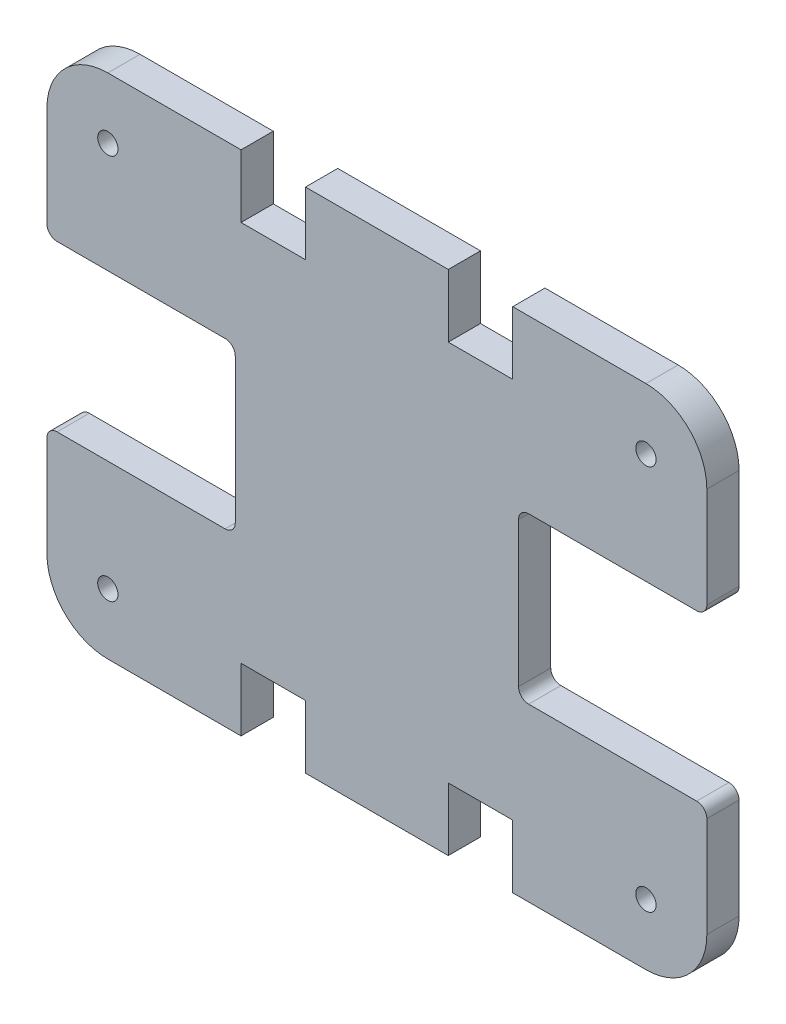
from build123d import *

# Parameters (mm, degrees)
OVERALL_DIMENSIONS_W    = 65
OVERALL_DIMENSIONS_H    = 50
RECTANGULAR_PLATE_DEPTH = 3.175
EXTERNAL_4_FILLETS_R    = 6
HOLE_POSITIONS_R        = 1
CORNER_HOLES_DEPTH      = 42.125790266
RJ45_GEOMETRY_W         = 18.55
RJ45_GEOMETRY_H         = 16.24
RJ45_CUTOUTS_DEPTH      = 42.125790266
CLIP_SLOT_GEOMETRY_W    = 6.35
CLIP_SLOT_GEOMETRY_H    = 6.2
CLIP_SLOTS_DEPTH        = 42.125790266
FILLET1_R               = 1


with BuildPart() as part:
    # overall dimensions → Rectangular Plate (new body)
    with BuildSketch(Plane.XY):
        Rectangle(OVERALL_DIMENSIONS_W, OVERALL_DIMENSIONS_H)
    extrude(amount=-RECTANGULAR_PLATE_DEPTH)

    # External 4 Fillets
    external_4_fillets_edges = [part.edges().sort_by_distance(p)[0] for p in [
        (32.5, -25, -1.5875),
        (-32.5, -25, -1.5875),
        (-32.5, 25, -1.5875),
        (32.5, 25, -1.5875),
    ]]
    fillet(external_4_fillets_edges, radius=EXTERNAL_4_FILLETS_R)

    # hole positions → Corner Holes (cut, through all)
    with BuildSketch(Plane.XY):
        with Locations((-26.5, 19)):
            Circle(HOLE_POSITIONS_R)
        with Locations(Location((26.5, 19, 0), (0, 0, 180))):
            Circle(HOLE_POSITIONS_R)
        with Locations((26.5, -19)):
            Circle(HOLE_POSITIONS_R)
        with Locations(Location((-26.5, -19, 0), (0, 0, 180))):
            Circle(HOLE_POSITIONS_R)
    extrude(amount=-CORNER_HOLES_DEPTH, mode=Mode.SUBTRACT)

    # RJ45 geometry → RJ45 cutouts (cut, through all)
    with BuildSketch(Plane.XY):
        with Locations((-23.225, 0)):
            Rectangle(RJ45_GEOMETRY_W, RJ45_GEOMETRY_H)
        with Locations((23.225, 0)):
            Rectangle(RJ45_GEOMETRY_W, RJ45_GEOMETRY_H)
    extrude(amount=-RJ45_CUTOUTS_DEPTH, mode=Mode.SUBTRACT)

    # clip slot geometry → clip slots (cut, through all)
    with BuildSketch(Plane.XY):
        with Locations((10.205, 21.9)):
            Rectangle(CLIP_SLOT_GEOMETRY_W, CLIP_SLOT_GEOMETRY_H)
        with Locations((-10.205, 21.9)):
            Rectangle(CLIP_SLOT_GEOMETRY_W, CLIP_SLOT_GEOMETRY_H)
        with Locations((-10.205, -21.9)):
            Rectangle(CLIP_SLOT_GEOMETRY_W, CLIP_SLOT_GEOMETRY_H)
        with Locations((10.205, -21.9)):
            Rectangle(CLIP_SLOT_GEOMETRY_W, CLIP_SLOT_GEOMETRY_H)
    extrude(amount=-CLIP_SLOTS_DEPTH, mode=Mode.SUBTRACT)

    # Fillet1
    fillet1_edges = [part.edges().sort_by_distance(p)[0] for p in [
        (32.5, -8.12, -1.5875),
        (13.95, -8.12, -1.5875),
        (13.95, 8.12, -1.5875),
        (32.5, 8.12, -1.5875),
        (-13.95, 8.12, -1.5875),
        (-13.95, -8.12, -1.5875),
        (-32.5, -8.12, -1.5875),
        (-32.5, 8.12, -1.5875),
    ]]
    fillet(fillet1_edges, radius=FILLET1_R)


solid = part.part
